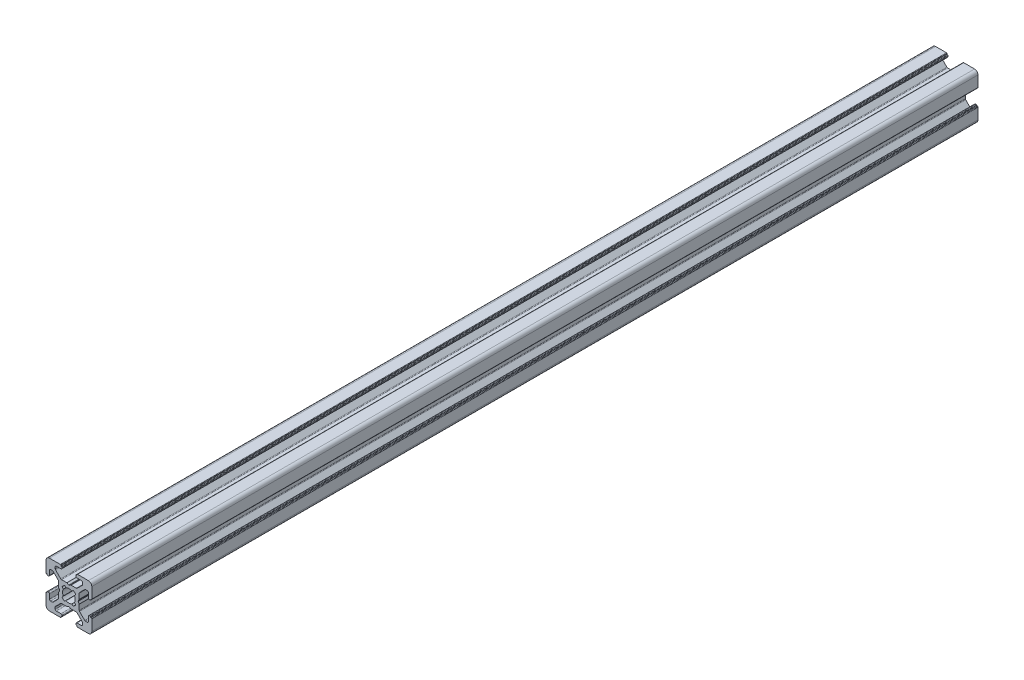
from build123d import *

# Parameters (mm, degrees)
EXTRUDE1_DEPTH = 387


with BuildPart() as part:
    # Sketch1 → Extrude1 (new body)
    with BuildSketch(Plane.XY):
        with BuildLine():
            Line((-3.5, 8.499999673), (-5.500000686, 8.499999673))
            ThreePointArc((-5.500000686, 8.499999673), (-5.853554077, 8.353553064), (-6.000000686, 7.999999673))
            Line((-6.000000686, 7.999999673), (-6.000000686, 7.267766626))
            ThreePointArc((-6.000000686, 7.267766626), (-5.961940448, 7.076424899), (-5.853554059, 6.914213219))
            Line((-5.853554059, 6.914213219), (-3.585787212, 4.646446592))
            ThreePointArc((-3.585787212, 4.646446592), (-3.423575544, 4.538060229), (-3.232233839, 4.5))
            Line((-3.232233839, 4.5), (-0.953590312, 4.5))
            ThreePointArc((-0.953590312, 4.5), (-0.901826505, 4.493185166), (-0.853590316, 4.473205083))
            Line((-0.853590316, 4.473205083), (-0.100000045, 4.038119562))
            ThreePointArc((-0.100000045, 4.038119562), (0, 4.011324632), (0.100000045, 4.038119562))
            Line((0.100000045, 4.038119562), (0.853590316, 4.473205083))
            ThreePointArc((0.853590316, 4.473205083), (0.901826505, 4.493185166), (0.953590312, 4.5))
            Line((0.953590312, 4.5), (3.232233839, 4.5))
            ThreePointArc((3.232233839, 4.5), (3.423575544, 4.538060229), (3.585787212, 4.646446592))
            Line((3.585787212, 4.646446592), (5.853554059, 6.914213219))
            ThreePointArc((5.853554059, 6.914213219), (5.961940448, 7.076424899), (6.000000686, 7.267766626))
            Line((6.000000686, 7.267766626), (6.000000686, 7.999999673))
            ThreePointArc((6.000000686, 7.999999673), (5.853554077, 8.353553064), (5.500000686, 8.499999673))
            Line((5.500000686, 8.499999673), (3.5, 8.499999673))
            ThreePointArc((3.5, 8.499999673), (3.146446609, 8.646446283), (3, 8.999999673))
            Line((3, 8.999999673), (3, 9.3))
            ThreePointArc((3, 9.3), (3.058578644, 9.441421356), (3.2, 9.5))
            Line((3.2, 9.5), (3.350000228, 9.5))
            ThreePointArc((3.350000228, 9.5), (3.491421584, 9.558578644), (3.550000228, 9.7))
            Line((3.550000228, 9.7), (3.550000228, 9.8))
            ThreePointArc((3.550000228, 9.8), (3.608578871, 9.941421356), (3.750000228, 10))
            Line((3.750000228, 10), (8.5, 10))
            ThreePointArc((8.5, 10), (9.560660172, 9.560660172), (10, 8.5))
            Line((10, 8.5), (10, 3.749999605))
            ThreePointArc((10, 3.749999605), (9.941421356, 3.608578248), (9.8, 3.549999605))
            Line((9.8, 3.549999605), (9.699999732, 3.549999605))
            ThreePointArc((9.699999732, 3.549999605), (9.558578376, 3.491420961), (9.499999732, 3.349999605))
            Line((9.499999732, 3.349999605), (9.499999732, 3.2))
            ThreePointArc((9.499999732, 3.2), (9.441421088, 3.058578644), (9.299999732, 3))
            Line((9.299999732, 3), (8.999999732, 3))
            ThreePointArc((8.999999732, 3), (8.646446341, 3.146446609), (8.499999732, 3.5))
            Line((8.499999732, 3.5), (8.499999732, 5.499999605))
            ThreePointArc((8.499999732, 5.499999605), (8.353553123, 5.853552995), (7.999999732, 5.999999605))
            Line((7.999999732, 5.999999605), (7.267766685, 5.999999605))
            ThreePointArc((7.267766685, 5.999999605), (7.076424969, 5.961939371), (6.914213294, 5.853552995))
            Line((6.914213294, 5.853552995), (4.646446398, 3.585786099))
            ThreePointArc((4.646446398, 3.585786099), (4.538060023, 3.423574425), (4.499999789, 3.232232708))
            Line((4.499999789, 3.232232708), (4.499999789, 0.953589302))
            ThreePointArc((4.499999789, 0.953589302), (4.493184953, 0.90182549), (4.473204867, 0.853589297))
            Line((4.473204867, 0.853589297), (4.038119841, 0.099999969))
            ThreePointArc((4.038119841, 0.099999969), (4.011324929, 0), (4.038119841, -0.099999969))
            Line((4.038119841, -0.099999969), (4.473204867, -0.853589297))
            ThreePointArc((4.473204867, -0.853589297), (4.493184953, -0.90182549), (4.499999789, -0.953589302))
            Line((4.499999789, -0.953589302), (4.499999789, -3.232232708))
            ThreePointArc((4.499999789, -3.232232708), (4.538060023, -3.423574425), (4.646446398, -3.585786099))
            Line((4.646446398, -3.585786099), (6.914213294, -5.853552995))
            ThreePointArc((6.914213294, -5.853552995), (7.076424969, -5.961939371), (7.267766685, -5.999999605))
            Line((7.267766685, -5.999999605), (7.999999732, -5.999999605))
            ThreePointArc((7.999999732, -5.999999605), (8.353553123, -5.853552995), (8.499999732, -5.499999605))
            Line((8.499999732, -5.499999605), (8.499999732, -3.5))
            ThreePointArc((8.499999732, -3.5), (8.646446341, -3.146446609), (8.999999732, -3))
            Line((8.999999732, -3), (9.299999732, -3))
            ThreePointArc((9.299999732, -3), (9.441421088, -3.058578644), (9.499999732, -3.2))
            Line((9.499999732, -3.2), (9.499999732, -3.349999605))
            ThreePointArc((9.499999732, -3.349999605), (9.558578376, -3.491420961), (9.699999732, -3.549999605))
            Line((9.699999732, -3.549999605), (9.8, -3.549999605))
            ThreePointArc((9.8, -3.549999605), (9.941421356, -3.608578248), (10, -3.749999605))
            Line((10, -3.749999605), (10, -8.5))
            ThreePointArc((10, -8.5), (9.560660172, -9.560660172), (8.5, -10))
            Line((8.5, -10), (3.750000228, -10))
            ThreePointArc((3.750000228, -10), (3.608578871, -9.941421356), (3.550000228, -9.8))
            Line((3.550000228, -9.8), (3.550000228, -9.7))
            ThreePointArc((3.550000228, -9.7), (3.491421584, -9.558578644), (3.350000228, -9.5))
            Line((3.350000228, -9.5), (3.2, -9.5))
            ThreePointArc((3.2, -9.5), (3.058578644, -9.441421356), (3, -9.3))
            Line((3, -9.3), (3, -8.999999673))
            ThreePointArc((3, -8.999999673), (3.146446609, -8.646446283), (3.5, -8.499999673))
            Line((3.5, -8.499999673), (5.500000686, -8.499999673))
            ThreePointArc((5.500000686, -8.499999673), (5.853554077, -8.353553064), (6.000000686, -7.999999673))
            Line((6.000000686, -7.999999673), (6.000000686, -7.267766626))
            ThreePointArc((6.000000686, -7.267766626), (5.961940448, -7.076424899), (5.853554059, -6.914213219))
            Line((5.853554059, -6.914213219), (3.585787212, -4.646446592))
            ThreePointArc((3.585787212, -4.646446592), (3.423575544, -4.538060229), (3.232233839, -4.5))
            Line((3.232233839, -4.5), (0.953590312, -4.5))
            ThreePointArc((0.953590312, -4.5), (0.901826505, -4.493185166), (0.853590316, -4.473205083))
            Line((0.853590316, -4.473205083), (0.100000045, -4.038119562))
            ThreePointArc((0.100000045, -4.038119562), (0, -4.011324632), (-0.100000045, -4.038119562))
            Line((-0.100000045, -4.038119562), (-0.853590316, -4.473205083))
            ThreePointArc((-0.853590316, -4.473205083), (-0.901826505, -4.493185166), (-0.953590312, -4.5))
            Line((-0.953590312, -4.5), (-3.232233839, -4.5))
            ThreePointArc((-3.232233839, -4.5), (-3.423575544, -4.538060229), (-3.585787212, -4.646446592))
            Line((-3.585787212, -4.646446592), (-5.853554059, -6.914213219))
            ThreePointArc((-5.853554059, -6.914213219), (-5.961940448, -7.076424899), (-6.000000686, -7.267766626))
            Line((-6.000000686, -7.267766626), (-6.000000686, -7.999999673))
            ThreePointArc((-6.000000686, -7.999999673), (-5.853554077, -8.353553064), (-5.500000686, -8.499999673))
            Line((-5.500000686, -8.499999673), (-3.5, -8.499999673))
            ThreePointArc((-3.5, -8.499999673), (-3.146446609, -8.646446283), (-3, -8.999999673))
            Line((-3, -8.999999673), (-3, -9.3))
            ThreePointArc((-3, -9.3), (-3.058578644, -9.441421356), (-3.2, -9.5))
            Line((-3.2, -9.5), (-3.350000228, -9.5))
            ThreePointArc((-3.350000228, -9.5), (-3.491421584, -9.558578644), (-3.550000228, -9.7))
            Line((-3.550000228, -9.7), (-3.550000228, -9.8))
            ThreePointArc((-3.550000228, -9.8), (-3.608578871, -9.941421356), (-3.750000228, -10))
            Line((-3.750000228, -10), (-8.5, -10))
            ThreePointArc((-8.5, -10), (-9.560660172, -9.560660172), (-10, -8.5))
            Line((-10, -8.5), (-10, -3.749999605))
            ThreePointArc((-10, -3.749999605), (-9.941421356, -3.608578248), (-9.8, -3.549999605))
            Line((-9.8, -3.549999605), (-9.699999732, -3.549999605))
            ThreePointArc((-9.699999732, -3.549999605), (-9.558578376, -3.491420961), (-9.499999732, -3.349999605))
            Line((-9.499999732, -3.349999605), (-9.499999732, -3.2))
            ThreePointArc((-9.499999732, -3.2), (-9.441421088, -3.058578644), (-9.299999732, -3))
            Line((-9.299999732, -3), (-8.999999732, -3))
            ThreePointArc((-8.999999732, -3), (-8.646446341, -3.146446609), (-8.499999732, -3.5))
            Line((-8.499999732, -3.5), (-8.499999732, -5.499999605))
            ThreePointArc((-8.499999732, -5.499999605), (-8.353553123, -5.853552995), (-7.999999732, -5.999999605))
            Line((-7.999999732, -5.999999605), (-7.267766685, -5.999999605))
            ThreePointArc((-7.267766685, -5.999999605), (-7.076424969, -5.961939371), (-6.914213294, -5.853552995))
            Line((-6.914213294, -5.853552995), (-4.646446398, -3.585786099))
            ThreePointArc((-4.646446398, -3.585786099), (-4.538060023, -3.423574425), (-4.499999789, -3.232232708))
            Line((-4.499999789, -3.232232708), (-4.499999789, -0.953589302))
            ThreePointArc((-4.499999789, -0.953589302), (-4.493184953, -0.90182549), (-4.473204867, -0.853589297))
            Line((-4.473204867, -0.853589297), (-4.038119841, -0.099999969))
            ThreePointArc((-4.038119841, -0.099999969), (-4.011324929, 0), (-4.038119841, 0.099999969))
            Line((-4.038119841, 0.099999969), (-4.473204867, 0.853589297))
            ThreePointArc((-4.473204867, 0.853589297), (-4.493184953, 0.90182549), (-4.499999789, 0.953589302))
            Line((-4.499999789, 0.953589302), (-4.499999789, 3.232232708))
            ThreePointArc((-4.499999789, 3.232232708), (-4.538060023, 3.423574425), (-4.646446398, 3.585786099))
            Line((-4.646446398, 3.585786099), (-6.914213294, 5.853552995))
            ThreePointArc((-6.914213294, 5.853552995), (-7.076424969, 5.961939371), (-7.267766685, 5.999999605))
            Line((-7.267766685, 5.999999605), (-7.999999732, 5.999999605))
            ThreePointArc((-7.999999732, 5.999999605), (-8.353553123, 5.853552995), (-8.499999732, 5.499999605))
            Line((-8.499999732, 5.499999605), (-8.499999732, 3.5))
            ThreePointArc((-8.499999732, 3.5), (-8.646446341, 3.146446609), (-8.999999732, 3))
            Line((-8.999999732, 3), (-9.299999732, 3))
            ThreePointArc((-9.299999732, 3), (-9.441421088, 3.058578644), (-9.499999732, 3.2))
            Line((-9.499999732, 3.2), (-9.499999732, 3.349999605))
            ThreePointArc((-9.499999732, 3.349999605), (-9.558578376, 3.491420961), (-9.699999732, 3.549999605))
            Line((-9.699999732, 3.549999605), (-9.8, 3.549999605))
            ThreePointArc((-9.8, 3.549999605), (-9.941421356, 3.608578248), (-10, 3.749999605))
            Line((-10, 3.749999605), (-10, 8.5))
            ThreePointArc((-10, 8.5), (-9.560660172, 9.560660172), (-8.5, 10))
            Line((-8.5, 10), (-3.750000228, 10))
            ThreePointArc((-3.750000228, 10), (-3.608578871, 9.941421356), (-3.550000228, 9.8))
            Line((-3.550000228, 9.8), (-3.550000228, 9.7))
            ThreePointArc((-3.550000228, 9.7), (-3.491421584, 9.558578644), (-3.350000228, 9.5))
            Line((-3.350000228, 9.5), (-3.2, 9.5))
            ThreePointArc((-3.2, 9.5), (-3.058578644, 9.441421356), (-3, 9.3))
            Line((-3, 9.3), (-3, 8.999999673))
            ThreePointArc((-3, 8.999999673), (-3.146446609, 8.646446283), (-3.5, 8.499999673))
        make_face()
        with BuildLine():
            Line((-1.258185436, 2.445295362), (-1.91389502, 2.989640962))
            ThreePointArc((-1.91389502, 2.989640962), (-2.511737261, 2.508410485), (-2.992174953, 1.909930962))
            Line((-2.992174953, 1.909930962), (-2.445295423, 1.258185317))
            ThreePointArc((-2.445295423, 1.258185317), (-2.75, 0), (-2.445295423, -1.258185317))
            Line((-2.445295423, -1.258185317), (-2.992174953, -1.909930962))
            ThreePointArc((-2.992174953, -1.909930962), (-2.511737261, -2.508410485), (-1.91389502, -2.989640962))
            Line((-1.91389502, -2.989640962), (-1.258185436, -2.445295362))
            ThreePointArc((-1.258185436, -2.445295362), (0, -2.75), (1.258185436, -2.445295362))
            Line((1.258185436, -2.445295362), (1.91389502, -2.989640962))
            ThreePointArc((1.91389502, -2.989640962), (2.511737261, -2.508410485), (2.992174953, -1.909930962))
            Line((2.992174953, -1.909930962), (2.445295423, -1.258185317))
            ThreePointArc((2.445295423, -1.258185317), (2.75, 0), (2.445295423, 1.258185317))
            Line((2.445295423, 1.258185317), (2.992174953, 1.909930962))
            ThreePointArc((2.992174953, 1.909930962), (2.511737261, 2.508410485), (1.91389502, 2.989640962))
            Line((1.91389502, 2.989640962), (1.258185436, 2.445295362))
            ThreePointArc((1.258185436, 2.445295362), (0, 2.75), (-1.258185436, 2.445295362))
        make_face(mode=Mode.SUBTRACT)
    extrude(amount=EXTRUDE1_DEPTH)


solid = part.part
